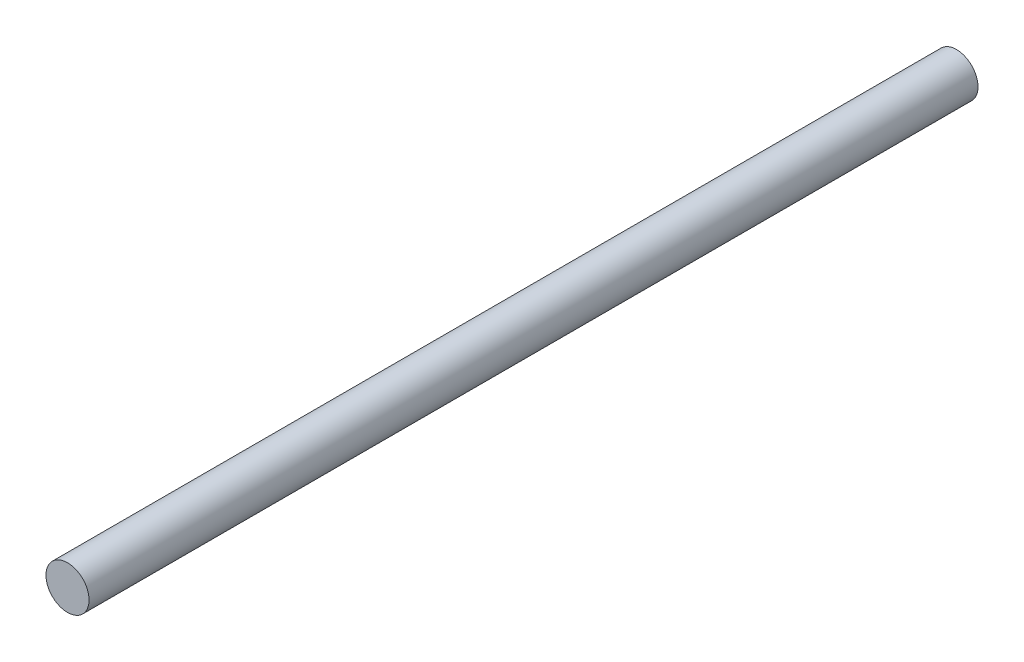
from build123d import *

# Parameters (mm, degrees)
SKETCH1_R           = 1.016
BOSS_EXTRUDE1_DEPTH = 41.91


with BuildPart() as part:
    # Sketch1 → Boss-Extrude1 (new body)
    with BuildSketch(Plane.XY):
        Circle(SKETCH1_R)
    extrude(amount=BOSS_EXTRUDE1_DEPTH)


solid = part.part
